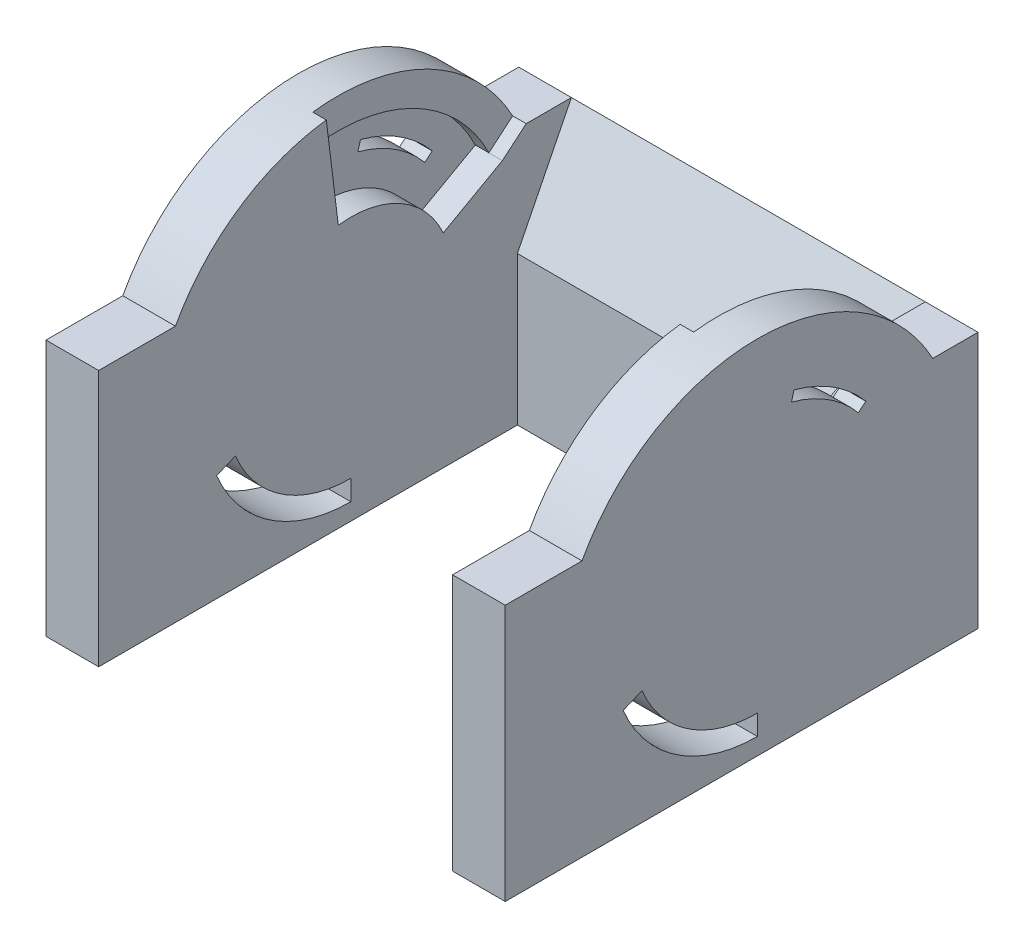
from build123d import *

# Parameters (mm, degrees)
CROQUIS1_W              = 34
CROQUIS1_H              = 19
SALIENTE_EXTRUIR1_DEPTH = 35
CROQUIS2_W              = 26.2
CROQUIS2_H              = 31
CORTAR_EXTRUIR1_DEPTH   = 25
CORTAR_EXTRUIR3_DEPTH   = 26.2
SALIENTE_EXTRUIR2_DEPTH = 34
CROQUIS10_W             = 26.2
CROQUIS10_H             = 25.966324345
CORTAR_EXTRUIR4_DEPTH   = 10
CORTAR_EXTRUIR5_START   = -34
CORTAR_EXTRUIR5_DEPTH   = 34
CORTAR_EXTRUIR6_DEPTH   = 2
CORTAR_EXTRUIR7_START   = 28.2
CORTAR_EXTRUIR7_DEPTH   = 28.2
CORTAR_EXTRUIR8_DEPTH   = 1
CORTAR_EXTRUIR9_DEPTH   = 27.2


with BuildPart() as part:
    # Croquis1 → Saliente-Extruir1 (new body)
    with BuildSketch(Plane.XY):
        with Locations((-31.887263086, 5.12254902)):
            Rectangle(CROQUIS1_W, CROQUIS1_H)
    extrude(amount=SALIENTE_EXTRUIR1_DEPTH)

    # Croquis2 → Cortar-Extruir1 (cut)
    with BuildSketch(Plane.XZ.offset(4.37745098)):
        with Locations((-31.887263086, 19.5)):
            Rectangle(CROQUIS2_W, CROQUIS2_H)
    extrude(amount=-CORTAR_EXTRUIR1_DEPTH, mode=Mode.SUBTRACT)

    # Croquis4 → Cortar-Extruir3 (cut)
    with BuildSketch(Plane.ZY.offset(18.787263086)):
        Polygon((4, 14.62254902), (4, 6.62254902), (0, 14.62254902), align=None)
    extrude(amount=CORTAR_EXTRUIR3_DEPTH, mode=Mode.SUBTRACT)

    # Croquis9 → Saliente-Extruir2 (add)
    with BuildSketch(Plane(origin=(-14.887263086, 0, 0), x_dir=(0, 0, -1), z_dir=(1, 0, 0))):
        with BuildLine():
            Line((-29.315831827, 14.62254902), (-3.349507482, 14.62254902))
            ThreePointArc((-3.349507482, 14.62254902), (-16.332669655, 22.37254902), (-29.315831827, 14.62254902))
        make_face()
    extrude(amount=-SALIENTE_EXTRUIR2_DEPTH)

    # Croquis10 → Cortar-Extruir4 (cut)
    with BuildSketch(Plane.XZ.offset(-14.62254902)):
        with Locations((-31.887263086, 16.332669655)):
            Rectangle(CROQUIS10_W, CROQUIS10_H)
    extrude(amount=-CORTAR_EXTRUIR4_DEPTH, mode=Mode.SUBTRACT)

    # Croquis11 → Cortar-Extruir5 (cut)
    with BuildSketch(Plane(origin=(-14.887263086, 0, 0), x_dir=(0, 0, -1), z_dir=(1, 0, 0)).offset(CORTAR_EXTRUIR5_START)):
        with BuildLine():
            Line((-26.264575199, 3.509186373), (-24.878727914, 4.083143951))
            ThreePointArc((-24.878727914, 4.083143951), (-21.471881808, -0.068419609), (-16.332669655, -1.62745098))
            Line((-16.332669655, -1.62745098), (-16.332669655, -3.12745098))
            ThreePointArc((-16.332669655, -3.12745098), (-22.305267563, -1.31560371), (-26.264575199, 3.509186373))
        make_face()
        with BuildLine():
            Line((-13.621540157, 17.74062205), (-13.807242822, 17.04757027))
            ThreePointArc((-13.807242822, 17.04757027), (-11.089968726, 15.851941052), (-8.857991001, 13.894549121))
            Line((-8.857991001, 13.894549121), (-8.308354113, 14.355749231))
            ThreePointArc((-8.308354113, 14.355749231), (-10.704456257, 16.457074414), (-13.621540157, 17.74062205))
        make_face()
    extrude(amount=CORTAR_EXTRUIR5_DEPTH, mode=Mode.SUBTRACT)

    # Croquis12 → Cortar-Extruir6 (cut)
    with BuildSketch(Plane.ZY.offset(18.787263086)):
        with BuildLine():
            Line((17.258889566, 15.065137056), (17.873210354, 20.027255157))
            ThreePointArc((17.873210354, 20.027255157), (10.39091869, 18.620075808), (5.112868034, 13.133089064))
            Line((5.112868034, 13.133089064), (9.488064371, 10.688715764))
            ThreePointArc((9.488064371, 10.688715764), (12.652304566, 14.157448622), (17.258889566, 15.065137056))
        make_face()
    extrude(amount=-CORTAR_EXTRUIR6_DEPTH, mode=Mode.SUBTRACT)

    # Croquis14 → Cortar-Extruir7 (cut)
    with BuildSketch(Plane.ZY.offset(18.787263086).offset(CORTAR_EXTRUIR7_START)):
        with BuildLine():
            Line((17.873210354, 20.027255157), (17.258889566, 15.065137056))
            ThreePointArc((17.258889566, 15.065137056), (12.652304566, 14.157448622), (9.488064371, 10.688715764))
            Line((9.488064371, 10.688715764), (5.112868034, 13.133089064))
            ThreePointArc((5.112868034, 13.133089064), (10.39091869, 18.620075808), (17.873210354, 20.027255157))
        make_face()
    extrude(amount=-CORTAR_EXTRUIR7_DEPTH, mode=Mode.SUBTRACT)

    # Croquis15 → Cortar-Extruir8 (cut)
    with BuildSketch(Plane.ZY.offset(18.787263086)):
        with BuildLine():
            Line((17.873210354, 20.027255157), (18.15050768, 22.260102262))
            ThreePointArc((18.15050768, 22.260102262), (9.568856329, 20.730307382), (3.349507482, 14.62254902))
            Line((3.349507482, 14.62254902), (5.112868034, 13.133089064))
            ThreePointArc((5.112868034, 13.133089064), (10.39091869, 18.620075808), (17.873210354, 20.027255157))
        make_face()
    extrude(amount=-CORTAR_EXTRUIR8_DEPTH, mode=Mode.SUBTRACT)

    # Croquis15<2> → Cortar-Extruir9 (cut)
    with BuildSketch(Plane.ZY.offset(18.787263086)):
        with BuildLine():
            Line((17.873210354, 20.027255157), (18.15050768, 22.260102262))
            ThreePointArc((18.15050768, 22.260102262), (9.568856329, 20.730307382), (3.349507482, 14.62254902))
            Line((3.349507482, 14.62254902), (5.112868034, 13.133089064))
            ThreePointArc((5.112868034, 13.133089064), (10.39091869, 18.620075808), (17.873210354, 20.027255157))
        make_face()
    extrude(amount=CORTAR_EXTRUIR9_DEPTH, mode=Mode.SUBTRACT)


solid = part.part
